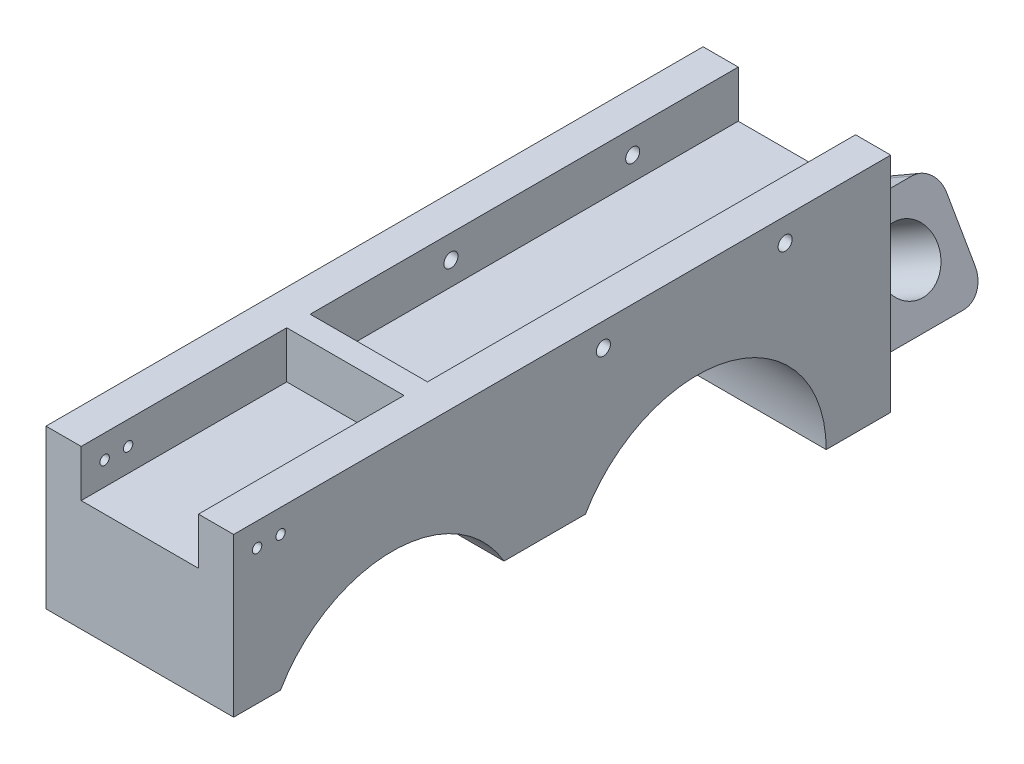
from build123d import *
from build123d.topology import SkipClean

# Parameters (mm, degrees)
SKETCH_1_R               = 3
SKETCH_1_R_2             = 2
EXTRUDE_1_DEPTH          = 80
CUT_EXTRUDE_4_REACH      = 297.59
CUT_EXTRUDE_4_END_RADIUS = 55
SKETCH_4_W               = 15
SKETCH_4_H               = 20
SKETCH_5_W               = 75
SKETCH_5_H               = 45
EXTRUDE_2_DEPTH          = 22.15
SKETCH_6_R               = 12.5
CUT_EXTRUDE_5_DEPTH      = 60
SKETCH_7_R               = 3
CUT_EXTRUDE_6_DEPTH      = 15
FILLET_1_R               = 10
SKETCH_8_R               = 1.5
CUT_EXTRUDE_7_DEPTH      = 15
CUT_EXTRUDE_8_REACH      = 300.317
CUT_EXTRUDE_8_END_RADIUS = 55
SKETCH_9_W               = 15
SKETCH_9_H               = 20
SKETCH_10_W              = 50
SKETCH_10_H              = 20
CUT_EXTRUDE_9_DEPTH      = 280.131397208
SKETCH_11_W              = 50
SKETCH_11_H              = 10
EXTRUDE_3_DEPTH          = 20


with BuildPart() as part:
    # Эскиз1 → Бобышка-Вытянуть1 (new body)
    with BuildSketch(Plane(origin=(0, 0, 0), x_dir=(0, 0, -1), z_dir=(1, 0, 0))):
        with BuildLine():
            Line((0, 0), (0, -95))
            Line((0, -95), (-27.5, -95))
            ThreePointArc((-27.5, -95), (-40.221163687, -59.821881801), (-72.5, -40.916730868))
            Line((-72.5, -40.916730868), (-72.5, -50))
            Line((-72.5, -50), (-92.5, -50))
            Line((-92.5, -50), (-92.5, -40.916730868))
            ThreePointArc((-92.5, -40.916730868), (-114.23345294, -50.077979069), (-130.131397208, -67.5))
            Line((-130.131397208, -67.5), (-164.868602792, -67.5))
            ThreePointArc((-164.868602792, -67.5), (-180.76654706, -50.077979069), (-202.5, -40.916730868))
            Line((-202.5, -40.916730868), (-202.5, -50))
            Line((-202.5, -50), (-222.5, -50))
            Line((-222.5, -50), (-222.5, -40.916730868))
            ThreePointArc((-222.5, -40.916730868), (-244.23345294, -50.077979069), (-260.131397208, -67.5))
            Line((-260.131397208, -67.5), (-280.131397208, -67.5))
            Line((-280.131397208, -67.5), (-280.131397208, 0))
            Line((-280.131397208, 0), (0, 0))
        make_face()
        with Locations((-45, -10)):
            Circle(SKETCH_1_R, mode=Mode.SUBTRACT)
        with Locations((-122.5, -10)):
            Circle(SKETCH_1_R, mode=Mode.SUBTRACT)
        with Locations((-260.131397208, -10)):
            Circle(SKETCH_1_R_2, mode=Mode.SUBTRACT)
        with Locations((-270.131397208, -10)):
            Circle(SKETCH_1_R_2, mode=Mode.SUBTRACT)
    extrude(amount=EXTRUDE_1_DEPTH)

    # Вырез-Вытянуть4: up to this cylinder (the profile starts inside it)
    with SkipClean():  # the faces are left unmerged after this step: merging them gives an invalid solid
        cut_extrude_4_end = Plane(origin=(40, -95, 82.5), z_dir=(-1, 0, 0)) * Cylinder(CUT_EXTRUDE_4_END_RADIUS, 771.18, mode=Mode.PRIVATE)
        # Эскиз4 → Вырез-Вытянуть4 (cut, up to the surface)
        with BuildSketch(Plane.XZ.offset(50), mode=Mode.PRIVATE) as cut_extrude_4_sk1:
            with Locations((7.5, 82.5)):
                Rectangle(SKETCH_4_W, SKETCH_4_H)
        cut_extrude_4_tool1 = extrude(cut_extrude_4_sk1.sketch, amount=-CUT_EXTRUDE_4_REACH, mode=Mode.PRIVATE) & cut_extrude_4_end
        add(cut_extrude_4_tool1.solids().sort_by_distance((7.5, -50, 82.5))[0], mode=Mode.SUBTRACT)
        # Эскиз4 → Вырез-Вытянуть4 (cut, up to the surface)
        with BuildSketch(Plane.XZ.offset(50), mode=Mode.PRIVATE) as cut_extrude_4_sk2:
            with Locations((72.5, 82.5)):
                Rectangle(SKETCH_4_W, SKETCH_4_H)
        cut_extrude_4_tool2 = extrude(cut_extrude_4_sk2.sketch, amount=-CUT_EXTRUDE_4_REACH, mode=Mode.PRIVATE) & cut_extrude_4_end
        add(cut_extrude_4_tool2.solids().sort_by_distance((72.5, -50, 82.5))[0], mode=Mode.SUBTRACT)

    # Эскиз5 → Бобышка-Вытянуть2 (add, symmetric)
    with SkipClean():  # the faces are left unmerged after this step: merging them gives an invalid solid
        with BuildSketch(Plane(origin=(41.13620668, -71.25, 0), x_dir=(-0.866025403784438, -0.500000000000001, 0), z_dir=(-0.500000000000001, 0.866025403784438, 0))):
            with Locations((10, -22.5)):
                Rectangle(SKETCH_5_W, SKETCH_5_H)
        extrude(amount=EXTRUDE_2_DEPTH, both=True)

    # Эскиз6 → Вырез-Вытянуть5 (cut)
    with SkipClean():  # the faces are left unmerged after this step: merging them gives an invalid solid
        with BuildSketch(Plane(origin=(23.815698604, 13.75, 0), x_dir=(0, 0, -1), z_dir=(0.8660254037844382, 0.500000000000001, 0))):
            with Locations(Location((22.5, -82.27241336, 0), (0, 0, 90))):
                Circle(SKETCH_6_R)
        extrude(amount=-CUT_EXTRUDE_5_DEPTH, mode=Mode.SUBTRACT)

    # Эскиз7 → Вырез-Вытянуть6 (cut)
    with SkipClean():  # the faces are left unmerged after this step: merging them gives an invalid solid
        with BuildSketch(Plane(origin=(-28.145825623, -16.25, 0), x_dir=(0, 0, -1), z_dir=(0.8660254037844382, 0.500000000000001, 0))):
            with Locations(Location((22.5, -82.27241336, 0), (0, 0, 90))):
                Circle(SKETCH_7_R)
        extrude(amount=-CUT_EXTRUDE_6_DEPTH, mode=Mode.SUBTRACT)

    # Скругление1
    fillet_1_edges = [part.edges().sort_by_distance(p)[0] for p in [
        (27.6875, -104.591231347, 0),
        (43.550952642, -95.432462694, -45),
        (21.400952642, -57.067537306, -45),
        (-5.5375, -72.620460191, 0),
    ]]
    fillet(fillet_1_edges, radius=FILLET_1_R)

    # Эскиз8 → Вырез-Вытянуть7 (cut)
    with BuildSketch(Plane(origin=(-41.13620668, -23.75, 0), x_dir=(0, 0, 1), z_dir=(-0.8660254037844382, -0.500000000000001, 0))):
        with Locations(Location((-22.5, -73.77241336, 0), (0, 0, 270))):
            Circle(SKETCH_8_R)
        with Locations(Location((-14, -82.27241336, 0), (0, 0, 270))):
            Circle(SKETCH_8_R)
        with Locations(Location((-22.5, -90.77241336, 0), (0, 0, 270))):
            Circle(SKETCH_8_R)
        with Locations(Location((-31, -82.27241336, 0), (0, 0, 270))):
            Circle(SKETCH_8_R)
    extrude(amount=-CUT_EXTRUDE_7_DEPTH, mode=Mode.SUBTRACT)

    # Вырез-Вытянуть8: up to this cylinder (the profile starts inside it)
    with SkipClean():  # the faces are left unmerged after this step: merging them gives an invalid solid
        cut_extrude_8_end = Plane(origin=(40, -95, 212.5), z_dir=(-1, 0, 0)) * Cylinder(CUT_EXTRUDE_8_END_RADIUS, 776.634, mode=Mode.PRIVATE)
        # Эскиз9 → Вырез-Вытянуть8 (cut, up to the surface)
        with BuildSketch(Plane.XZ.offset(50), mode=Mode.PRIVATE) as cut_extrude_8_sk1:
            with Locations((7.5, 212.5)):
                Rectangle(SKETCH_9_W, SKETCH_9_H)
        cut_extrude_8_tool1 = extrude(cut_extrude_8_sk1.sketch, amount=-CUT_EXTRUDE_8_REACH, mode=Mode.PRIVATE) & cut_extrude_8_end
        add(cut_extrude_8_tool1.solids().sort_by_distance((7.5, -50, 212.5))[0], mode=Mode.SUBTRACT)
        # Эскиз9 → Вырез-Вытянуть8 (cut, up to the surface)
        with BuildSketch(Plane.XZ.offset(50), mode=Mode.PRIVATE) as cut_extrude_8_sk2:
            with Locations((72.5, 212.5)):
                Rectangle(SKETCH_9_W, SKETCH_9_H)
        cut_extrude_8_tool2 = extrude(cut_extrude_8_sk2.sketch, amount=-CUT_EXTRUDE_8_REACH, mode=Mode.PRIVATE) & cut_extrude_8_end
        add(cut_extrude_8_tool2.solids().sort_by_distance((72.5, -50, 212.5))[0], mode=Mode.SUBTRACT)

    # Эскиз10 → Вырез-Вытянуть9 (cut)
    with SkipClean():  # the faces are left unmerged after this step: merging them gives an invalid solid
        with BuildSketch(Plane(origin=(0, 0, 0), x_dir=(-1, 0, 0), z_dir=(0, 0, -1))):
            with Locations((-40, -10)):
                Rectangle(SKETCH_10_W, SKETCH_10_H)
        extrude(amount=-CUT_EXTRUDE_9_DEPTH, mode=Mode.SUBTRACT)

    # Эскиз11 → Бобышка-Вытянуть3 (add)
    with SkipClean():  # the faces are left unmerged after this step: merging them gives an invalid solid
        with BuildSketch(Plane(origin=(0, -20, 0), x_dir=(1, 0, 0), z_dir=(0, 1, 0))):
            with Locations((40, -187.5)):
                Rectangle(SKETCH_11_W, SKETCH_11_H)
        extrude(amount=EXTRUDE_3_DEPTH)


solid = part.part
